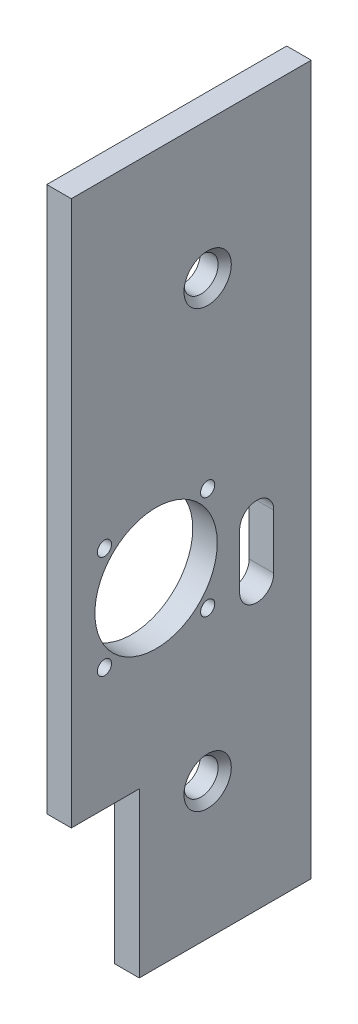
from build123d import *

# Parameters (mm, degrees)
SKETCH1_R             = 3.9751
SKETCH1_R_2           = 14.249999948
BOSS_EXTRUDE1_DEPTH   = 5.715
M4X0_7_TAPPED_HOLE1_D = 3.3
CHAMFER1_SIZE         = 1.5367


with BuildPart() as part:
    # Sketch1 → Boss-Extrude1 (new body)
    with BuildSketch(Plane.YZ):
        Polygon((-165.1, 0), (0, 0), (0, 55.88), (-126.937814396, 55.88), (-126.937814396, 40.052578354), (-165.1, 40.052578354), align=None)
        with BuildLine():
            ThreePointArc((-99.098846149, 8.73125), (-103.067596149, 12.7), (-99.098846149, 16.66875))
            Line((-99.098846149, 16.66875), (-86.398846149, 16.66875))
            ThreePointArc((-86.398846149, 16.66875), (-82.430096149, 12.7), (-86.398846149, 8.73125))
            Line((-86.398846149, 8.73125), (-99.098846149, 8.73125))
        make_face(mode=Mode.SUBTRACT)
        with Locations(Location((-133.35, 24.13, 0), (0, 0, 270))):
            Circle(SKETCH1_R, mode=Mode.SUBTRACT)
        with Locations(Location((-31.9024, 24.13, 0), (0, 0, 270))):
            Circle(SKETCH1_R, mode=Mode.SUBTRACT)
        with Locations(Location((-86.398846149, 36.137660549, 0), (0, 0, 270))):
            Circle(SKETCH1_R_2, mode=Mode.SUBTRACT)
    extrude(amount=BOSS_EXTRUDE1_DEPTH)

    # M4x0.7 Tapped Hole1 (through all)
    with Locations(Plane(origin=(5.715, 0, 0), x_dir=(0, 0, -1), z_dir=(1, 0, 0))):
        with Locations((-48.158475855, -74.378030844), (-24.116845244, -74.378030844), (-24.116845244, -98.419661455), (-48.158475855, -98.419661455)):
            Hole(M4X0_7_TAPPED_HOLE1_D / 2)

    # Chamfer1
    chamfer1_edges = [part.edges().sort_by_distance(p)[0] for p in [
        (5.715, -31.9024, 28.1051),
        (5.715, -133.35, 28.1051),
    ]]
    chamfer(chamfer1_edges, length=CHAMFER1_SIZE)


solid = part.part
